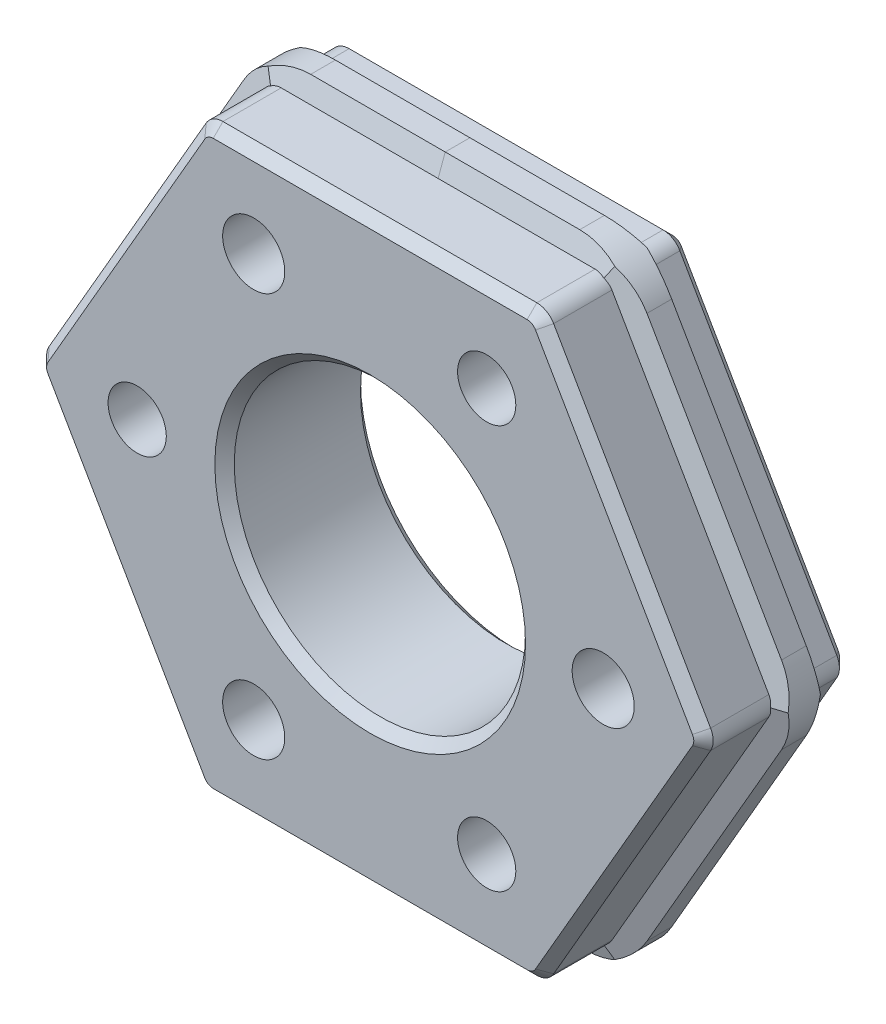
from build123d import *

# Parameters (mm, degrees)
SKETCH_1_W                   = 40
SKETCH_1_H                   = 40
SKETCH_1_R                   = 7.5
EXTRUDE_1_DEPTH              = 3
SKETCH_23_W                  = 40
SKETCH_23_H                  = 40
SKETCH_23_R                  = 7.5
EXTRUDE_4_DEPTH              = 1.5
HOLE_WIZARD_M3_1_D           = 3.2
HOLE_WIZARD_M3_1_CBORE_D     = 6
HOLE_WIZARD_M3_1_CBORE_DEPTH = 4
F_3_0MM_1_D                  = 3
F_3_0MM_1_DEPTH              = 4
F_3_0MM_1_TIP                = 0.901290929
SKETCH_26_OUTSIDE_W          = 53.412
SKETCH_26_OUTSIDE_H          = 53.412
CUT_EXTRUDE_1_DEPTH          = 30.261749777
FILLET_2_R                   = 4
FILLET_3_R                   = 1
CHAMFER_1_SIZE               = 0.5


with BuildPart() as part:
    # 草图1 → 凸台-拉伸1 (new, symmetric)
    with BuildSketch(Plane.XY):
        Rectangle(SKETCH_1_W, SKETCH_1_H)
        Circle(SKETCH_1_R, mode=Mode.SUBTRACT)
    extrude(amount=EXTRUDE_1_DEPTH, both=True)

    # 草图23 → 凸台-拉伸4 (add)
    with BuildSketch(Plane.XY.offset(3)):
        Rectangle(SKETCH_23_W, SKETCH_23_H)
        Circle(SKETCH_23_R, mode=Mode.SUBTRACT)
    extrude(amount=EXTRUDE_4_DEPTH)

    # M3 六角圆柱头螺钉的柱形沉头孔1 (through all)
    with Locations(Plane(origin=(0, 0, -3), x_dir=(-1, 0, 0), z_dir=(0, 0, -1))):
        with Locations((-12, 0), (6, 10.392304845), (6, -10.392304845)):
            CounterBoreHole(HOLE_WIZARD_M3_1_D / 2, HOLE_WIZARD_M3_1_CBORE_D / 2, HOLE_WIZARD_M3_1_CBORE_DEPTH)

    # Ø3.0mm 暗销孔1
    with Locations(Plane.XY.offset(4.5)):
        with Locations((-12, 0), (6, 10.392304845), (6, -10.392304845)):
            Hole(F_3_0MM_1_D / 2, depth=F_3_0MM_1_DEPTH)
            with Locations((0, 0, -(F_3_0MM_1_DEPTH + F_3_0MM_1_TIP / 2))):  # 118° drill point
                Cone(0, F_3_0MM_1_D / 2, F_3_0MM_1_TIP, mode=Mode.SUBTRACT)

    # 草图26 outside → 切除-拉伸1 (cut, through all)
    with BuildSketch(Plane(origin=(0, 0, -3), x_dir=(-1, 0, 0), z_dir=(0, 0, -1))):
        Rectangle(SKETCH_26_OUTSIDE_W, SKETCH_26_OUTSIDE_H)
        Polygon((-17.320508076, 0), (-8.660254038, -15), (8.660254038, -15), (17.320508076, 0), (8.660254038, 15), (-8.660254038, 15), align=None, mode=Mode.SUBTRACT)
    extrude(amount=-CUT_EXTRUDE_1_DEPTH, mode=Mode.SUBTRACT)

    # 扫描1: sweep along a path in 草图44
    with BuildLine(Plane(origin=(0, 0, -1), x_dir=(-1, 0, 0), z_dir=(0, 0, -1))) as sweep_1_path:
        Line((-17.320508076, 0), (-8.660254038, -15))
        Line((-8.660254038, -15), (8.660254038, -15))
        Line((8.660254038, -15), (17.320508076, 0))
        Line((17.320508076, 0), (8.660254038, 15))
        Line((8.660254038, 15), (-8.660254038, 15))
        Line((-8.660254038, 15), (-17.320508076, 0))
    # 草图43 → 扫描1 (sweep)
    with BuildSketch(Plane(origin=(0, 0, 0), x_dir=(0, 0, -1), z_dir=(1, 0, 0))):
        Polygon((-1, 15), (1, 15), (0.636029766, 16), (-0.636029766, 16), align=None)
    sweep(path=sweep_1_path.line, transition=Transition.RIGHT)

    # 圆角2
    fillet_2_edges = [part.edges().sort_by_distance(p)[0] for p in [
        (-18.475208614, 0, 0),
        (-9.237604307, 16, 0),
        (-9.237604307, -16, 0),
        (9.237604307, 16, 0),
        (9.237604307, -16, 0),
        (18.475208614, 0, 0),
    ]]
    fillet(fillet_2_edges, radius=FILLET_2_R)

    # 圆角3
    fillet_3_edges = [part.edges().sort_by_distance(p)[0] for p in [
        (17.320508076, 0, -2),
        (8.660254038, -15, -2),
        (-8.660254038, -15, -2),
        (-17.320508076, 0, -2),
        (-8.660254038, 15, -2),
        (8.660254038, 15, -2),
        (8.660254038, 15, 2.75),
        (-8.660254038, 15, 2.75),
        (-17.320508076, 0, 2.75),
        (-8.660254038, -15, 2.75),
        (8.660254038, -15, 2.75),
        (17.320508076, 0, 2.75),
    ]]
    fillet(fillet_3_edges, radius=FILLET_3_R)

    # 倒角1
    chamfer_1_edges = [part.edges().sort_by_distance(p)[0] for p in [
        (-7.5, 0, -3),
        (-12.990381057, 7.5, -3),
        (12.990381057, 7.5, -3),
        (12.990381057, -7.5, -3),
        (0, -15, -3),
        (-12.990381057, -7.5, -3),
        (-7.5, 0, 4.5),
        (0, 15, -3),
        (8.582903769, 14.866025404, -3),
        (17.165807537, 0, -3),
        (8.582903769, -14.866025404, -3),
        (-8.582903769, -14.866025404, -3),
        (-17.165807537, 0, -3),
        (-8.582903769, 14.866025404, -3),
        (-12.990381057, 7.5, 4.5),
        (0, 15, 4.5),
        (12.990381057, -7.5, 4.5),
        (12.990381057, 7.5, 4.5),
        (-12.990381057, -7.5, 4.5),
        (0, -15, 4.5),
        (8.582903769, 14.866025404, 4.5),
        (17.165807537, 0, 4.5),
        (8.582903769, -14.866025404, 4.5),
        (-8.582903769, -14.866025404, 4.5),
        (-17.165807537, 0, 4.5),
        (-8.582903769, 14.866025404, 4.5),
    ]]
    chamfer(chamfer_1_edges, length=CHAMFER_1_SIZE)


solid = part.part
